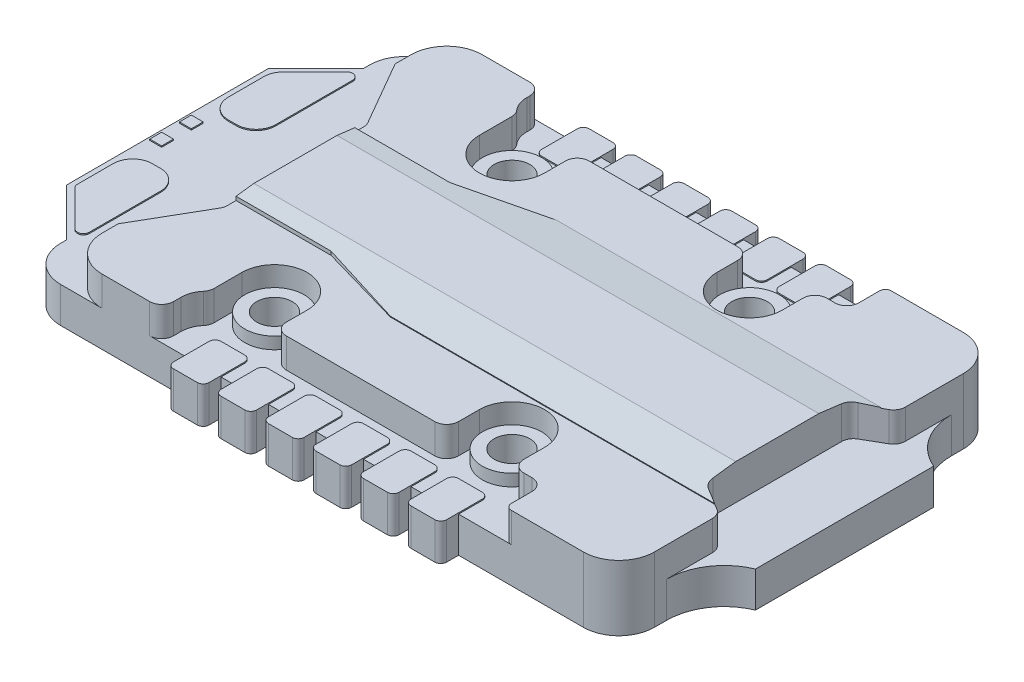
from build123d import *

# Parameters (mm, degrees)
BOSS_EXTRUDE1_DEPTH      = 3
SKETCH2_R                = 2.5
BOSS_EXTRUDE2_DEPTH      = 1
SKETCH3_R                = 1.5
CUT_EXTRUDE1_DEPTH       = 34.361654635
BOSS_EXTRUDE3_START      = 2.5
BOSS_EXTRUDE3_DEPTH      = 2.5
BOSS_EXTRUDE4_START      = 0.5
BOSS_EXTRUDE4_DEPTH      = 0.5
CUT_EXTRUDE2_DEPTH       = 50.015157952
CUT_EXTRUDE2_DEPTH_BACK  = 50.015157952
BOSS_EXTRUDE5_DEPTH      = 0.1
BOSS_EXTRUDE5_DEPTH_BACK = 3
SKETCH7_W                = 1
SKETCH7_H                = 1


with BuildPart() as part:
    # Sketch1 → Boss-Extrude1 (new body)
    with BuildSketch(Plane(origin=(0, 0, 0), x_dir=(1, 0, 0), z_dir=(0, 1, 0))):
        with BuildLine():
            Line((22, 16), (-22, 16))
            ThreePointArc((-22, 16), (-24.121320344, 15.121320344), (-25, 13))
            Line((-25, 13), (-25, 12.5))
            Line((-25, 12.5), (-29, 8.5))
            Line((-29, 8.5), (-29, -8.5))
            Line((-29, -8.5), (-25, -12.5))
            Line((-25, -12.5), (-25, -13))
            ThreePointArc((-25, -13), (-24.121320344, -15.121320344), (-22, -16))
            Line((-22, -16), (22, -16))
            ThreePointArc((22, -16), (24.121320344, -15.121320344), (25, -13))
            Line((25, -13), (25, -12))
            ThreePointArc((25, -12), (25.818754815, -9.295836543), (28, -7.5))
            Line((28, -7.5), (28, 7.5))
            ThreePointArc((28, 7.5), (25.818754815, 9.295836543), (25, 12))
            Line((25, 12), (25, 13))
            ThreePointArc((25, 13), (24.121320344, 15.121320344), (22, 16))
        make_face()
    extrude(amount=-BOSS_EXTRUDE1_DEPTH)

    # Sketch2 → Boss-Extrude2 (add)
    with BuildSketch(Plane(origin=(0, 0, 0), x_dir=(1, 0, 0), z_dir=(0, 1, 0))):
        with Locations(Location((-10, 10, 0), (0, 0, 270))):
            Circle(SKETCH2_R)
        with Locations(Location((10, 10, 0), (0, 0, 270))):
            Circle(SKETCH2_R)
        with Locations(Location((10, -10, 0), (0, 0, 270))):
            Circle(SKETCH2_R)
        with Locations(Location((-10, -10, 0), (0, 0, 270))):
            Circle(SKETCH2_R)
    extrude(amount=BOSS_EXTRUDE2_DEPTH)

    # Sketch3 → Cut-Extrude1 (cut, through all)
    with BuildSketch(Plane(origin=(0, 1, 0), x_dir=(1, 0, 0), z_dir=(0, 1, 0))):
        with Locations(Location((-10, 10, 0), (0, 0, 270))):
            Circle(SKETCH3_R)
        with Locations(Location((10, 10, 0), (0, 0, 270))):
            Circle(SKETCH3_R)
        with Locations(Location((10, -10, 0), (0, 0, 270))):
            Circle(SKETCH3_R)
        with Locations(Location((-10, -10, 0), (0, 0, 270))):
            Circle(SKETCH3_R)
    extrude(amount=-CUT_EXTRUDE1_DEPTH, mode=Mode.SUBTRACT)

    # Sketch4 → Boss-Extrude3 (add)
    with BuildSketch(Plane(origin=(0, 0, 0), x_dir=(1, 0, 0), z_dir=(0, 1, 0)).offset(BOSS_EXTRUDE3_START)):
        with BuildLine():
            ThreePointArc((-7.25, 10), (-10, 7.25), (-12.75, 10))
            Line((-12.75, 10), (-12.75, 12.734819154))
            ThreePointArc((-12.75, 12.734819154), (-12.813231765, 13.084769541), (-12.994930547, 13.390463967))
            ThreePointArc((-12.994930547, 13.390463967), (-13.36961025, 14.020834162), (-13.5, 14.742464244))
            Line((-13.5, 14.742464244), (-13.5, 15))
            ThreePointArc((-13.5, 15), (-13.792893219, 15.707106781), (-14.5, 16))
            Line((-14.5, 16), (-18.5, 16))
            ThreePointArc((-18.5, 16), (-20.621320344, 15.121320344), (-21.5, 13))
            Line((-21.5, 13), (-21.5, 11.658695779))
            Line((-21.5, 11.658695779), (-18.366925065, 6.232050808))
            ThreePointArc((-18.366925065, 6.232050808), (-18.267024642, 5.990869853), (-18.232950469, 5.732050808))
            Line((-18.232950469, 5.732050808), (-18.232950469, -5.732050808))
            ThreePointArc((-18.232950469, -5.732050808), (-18.267024642, -5.990869853), (-18.366925065, -6.232050808))
            Line((-18.366925065, -6.232050808), (-21.5, -11.658695779))
            Line((-21.5, -11.658695779), (-21.5, -13))
            ThreePointArc((-21.5, -13), (-20.621320344, -15.121320344), (-18.5, -16))
            Line((-18.5, -16), (-14.5, -16))
            ThreePointArc((-14.5, -16), (-13.792893219, -15.707106781), (-13.5, -15))
            Line((-13.5, -15), (-13.5, -14.357870566))
            ThreePointArc((-13.5, -14.357870566), (-13.368919263, -13.627827211), (-12.992052723, -12.988986799))
            ThreePointArc((-12.992052723, -12.988986799), (-12.81246406, -12.684559415), (-12.75, -12.336670982))
            Line((-12.75, -12.336670982), (-12.75, -10))
            ThreePointArc((-12.75, -10), (-10, -7.25), (-7.25, -10))
            Line((-7.25, -10), (-7.25, -11.75))
            ThreePointArc((-7.25, -11.75), (-6.957106781, -12.457106781), (-6.25, -12.75))
            Line((-6.25, -12.75), (6.25, -12.75))
            ThreePointArc((6.25, -12.75), (6.957106781, -12.457106781), (7.25, -11.75))
            Line((7.25, -11.75), (7.25, -10))
            ThreePointArc((7.25, -10), (10, -7.25), (12.75, -10))
            Line((12.75, -10), (12.75, -11.75))
            ThreePointArc((12.75, -11.75), (13.042893219, -12.457106781), (13.75, -12.75))
            Line((13.75, -12.75), (14.440772893, -12.75))
            ThreePointArc((14.440772893, -12.75), (15.147879675, -13.042893219), (15.440772893, -13.75))
            Line((15.440772893, -13.75), (15.440772893, -15.5))
            ThreePointArc((15.440772893, -15.5), (15.587219503, -15.853553391), (15.940772893, -16))
            Line((15.940772893, -16), (22, -16))
            ThreePointArc((22, -16), (24.121320344, -15.121320344), (25, -13))
            Line((25, -13), (25, -8.117354083))
            ThreePointArc((25, -8.117354083), (24.866025404, -7.617354083), (24.5, -7.251328679))
            Line((24.5, -7.251328679), (22.832635151, -6.288675135))
            ThreePointArc((22.832635151, -6.288675135), (22.466609747, -5.922649731), (22.332635151, -5.422649731))
            Line((22.332635151, -5.422649731), (22.332635151, 5.422649731))
            ThreePointArc((22.332635151, 5.422649731), (22.466609747, 5.922649731), (22.832635151, 6.288675135))
            Line((22.832635151, 6.288675135), (24.5, 7.251328679))
            ThreePointArc((24.5, 7.251328679), (24.866025404, 7.617354083), (25, 8.117354083))
            Line((25, 8.117354083), (25, 13))
            ThreePointArc((25, 13), (24.121320344, 15.121320344), (22, 16))
            Line((22, 16), (15.940772893, 16))
            ThreePointArc((15.940772893, 16), (15.587219503, 15.853553391), (15.440772893, 15.5))
            Line((15.440772893, 15.5), (15.440772893, 13.75))
            ThreePointArc((15.440772893, 13.75), (15.147879675, 13.042893219), (14.440772893, 12.75))
            Line((14.440772893, 12.75), (13.75, 12.75))
            ThreePointArc((13.75, 12.75), (13.042893219, 12.457106781), (12.75, 11.75))
            Line((12.75, 11.75), (12.75, 10))
            ThreePointArc((12.75, 10), (10, 7.25), (7.25, 10))
            Line((7.25, 10), (7.25, 11.75))
            ThreePointArc((7.25, 11.75), (6.957106781, 12.457106781), (6.25, 12.75))
            Line((6.25, 12.75), (-6.25, 12.75))
            ThreePointArc((-6.25, 12.75), (-6.957106781, 12.457106781), (-7.25, 11.75))
            Line((-7.25, 11.75), (-7.25, 10))
        make_face()
    extrude(amount=-BOSS_EXTRUDE3_DEPTH)

    # Sketch5 → Boss-Extrude4 (add)
    with BuildSketch(Plane(origin=(0, 2.5, 0), x_dir=(1, 0, 0), z_dir=(0, 1, 0)).offset(BOSS_EXTRUDE4_START)):
        with BuildLine():
            Line((-18.232950469, 5), (-10.232950469, 5))
            Line((-10.232950469, 5), (-3.232950469, 7))
            Line((-3.232950469, 7), (24.064685959, 7))
            Line((24.064685959, 7), (22.832635151, 6.288675135))
            ThreePointArc((22.832635151, 6.288675135), (22.466609747, 5.922649731), (22.332635151, 5.422649731))
            Line((22.332635151, 5.422649731), (22.332635151, -5.422649731))
            ThreePointArc((22.332635151, -5.422649731), (22.466609747, -5.922649731), (22.832635151, -6.288675135))
            Line((22.832635151, -6.288675135), (24.064685959, -7))
            Line((24.064685959, -7), (-3.232950469, -7))
            Line((-3.232950469, -7), (-10.232950469, -5))
            Line((-10.232950469, -5), (-18.232950469, -5))
            Line((-18.232950469, -5), (-18.232950469, 5))
        make_face()
    extrude(amount=-BOSS_EXTRUDE4_DEPTH)

    # Sketch6 → Cut-Extrude2 (cut, two sides: drawn at the far end of the back side and taken through both)
    with BuildSketch(Plane.ZY.offset(18.232950469).offset(-CUT_EXTRUDE2_DEPTH_BACK)):
        Polygon((-3.5, 3), (3.5, 3), (7.5, 2.5), (7.5, 6.225163496), (-7.5, 6.225163496), (-7.5, 2.5), align=None)
    extrude(amount=CUT_EXTRUDE2_DEPTH + CUT_EXTRUDE2_DEPTH_BACK, mode=Mode.SUBTRACT)

    # Sketch7 → Boss-Extrude5 (add, two sides: drawn at the far end of the back side and taken through both)
    with BuildSketch(Plane(origin=(0, 0, 0), x_dir=(1, 0, 0), z_dir=(0, 1, 0)).offset(-BOSS_EXTRUDE5_DEPTH_BACK)):
        with BuildLine():
            Line((-11, -13.5), (-9, -13.5))
            ThreePointArc((-9, -13.5), (-8.646446609, -13.646446609), (-8.5, -14))
            Line((-8.5, -14), (-8.5, -17))
            ThreePointArc((-8.5, -17), (-8.646446609, -17.353553391), (-9, -17.5))
            Line((-9, -17.5), (-11, -17.5))
            ThreePointArc((-11, -17.5), (-11.353553391, -17.353553391), (-11.5, -17))
            Line((-11.5, -17), (-11.5, -14))
            ThreePointArc((-11.5, -14), (-11.353553391, -13.646446609), (-11, -13.5))
        make_face()
        with BuildLine():
            Line((-7, -13.5), (-5, -13.5))
            ThreePointArc((-5, -13.5), (-4.646446609, -13.646446609), (-4.5, -14))
            Line((-4.5, -14), (-4.5, -17))
            ThreePointArc((-4.5, -17), (-4.646446609, -17.353553391), (-5, -17.5))
            Line((-5, -17.5), (-7, -17.5))
            ThreePointArc((-7, -17.5), (-7.353553391, -17.353553391), (-7.5, -17))
            Line((-7.5, -17), (-7.5, -14))
            ThreePointArc((-7.5, -14), (-7.353553391, -13.646446609), (-7, -13.5))
        make_face()
        with BuildLine():
            Line((-3, -13.5), (-1, -13.5))
            ThreePointArc((-1, -13.5), (-0.646446609, -13.646446609), (-0.5, -14))
            Line((-0.5, -14), (-0.5, -17))
            ThreePointArc((-0.5, -17), (-0.646446609, -17.353553391), (-1, -17.5))
            Line((-1, -17.5), (-3, -17.5))
            ThreePointArc((-3, -17.5), (-3.353553391, -17.353553391), (-3.5, -17))
            Line((-3.5, -17), (-3.5, -14))
            ThreePointArc((-3.5, -14), (-3.353553391, -13.646446609), (-3, -13.5))
        make_face()
        with BuildLine():
            Line((1, -13.5), (3, -13.5))
            ThreePointArc((3, -13.5), (3.353553391, -13.646446609), (3.5, -14))
            Line((3.5, -14), (3.5, -17))
            ThreePointArc((3.5, -17), (3.353553391, -17.353553391), (3, -17.5))
            Line((3, -17.5), (1, -17.5))
            ThreePointArc((1, -17.5), (0.646446609, -17.353553391), (0.5, -17))
            Line((0.5, -17), (0.5, -14))
            ThreePointArc((0.5, -14), (0.646446609, -13.646446609), (1, -13.5))
        make_face()
        with BuildLine():
            Line((5, -13.5), (7, -13.5))
            ThreePointArc((7, -13.5), (7.353553391, -13.646446609), (7.5, -14))
            Line((7.5, -14), (7.5, -17))
            ThreePointArc((7.5, -17), (7.353553391, -17.353553391), (7, -17.5))
            Line((7, -17.5), (5, -17.5))
            ThreePointArc((5, -17.5), (4.646446609, -17.353553391), (4.5, -17))
            Line((4.5, -17), (4.5, -14))
            ThreePointArc((4.5, -14), (4.646446609, -13.646446609), (5, -13.5))
        make_face()
        with BuildLine():
            Line((9, -13.5), (11, -13.5))
            ThreePointArc((11, -13.5), (11.353553391, -13.646446609), (11.5, -14))
            Line((11.5, -14), (11.5, -17))
            ThreePointArc((11.5, -17), (11.353553391, -17.353553391), (11, -17.5))
            Line((11, -17.5), (9, -17.5))
            ThreePointArc((9, -17.5), (8.646446609, -17.353553391), (8.5, -17))
            Line((8.5, -17), (8.5, -14))
            ThreePointArc((8.5, -14), (8.646446609, -13.646446609), (9, -13.5))
        make_face()
        with BuildLine():
            Line((-28.353553391, -8.439339828), (-26.505151476, -10.287741743))
            Line((-26.505151476, -10.287741743), (-25.353553391, -11.439339828))
            ThreePointArc((-25.353553391, -11.439339828), (-24.808658284, -11.547726204), (-24.5, -11.085786438))
            Line((-24.5, -11.085786438), (-24.5, -5.085786438))
            ThreePointArc((-24.5, -5.085786438), (-24.983741879, -3.917930232), (-26.151598085, -3.434188352))
            Line((-26.151598085, -3.434188352), (-26.848401915, -3.434188352))
            ThreePointArc((-26.848401915, -3.434188352), (-28.016258121, -3.917930232), (-28.5, -5.085786438))
            Line((-28.5, -5.085786438), (-28.5, -8.085786438))
            ThreePointArc((-28.5, -8.085786438), (-28.461939766, -8.277128154), (-28.353553391, -8.439339828))
        make_face()
        with BuildLine():
            Line((-11, 17.5), (-9, 17.5))
            ThreePointArc((-9, 17.5), (-8.646446609, 17.353553391), (-8.5, 17))
            Line((-8.5, 17), (-8.5, 14))
            ThreePointArc((-8.5, 14), (-8.646446609, 13.646446609), (-9, 13.5))
            Line((-9, 13.5), (-11, 13.5))
            ThreePointArc((-11, 13.5), (-11.353553391, 13.646446609), (-11.5, 14))
            Line((-11.5, 14), (-11.5, 17))
            ThreePointArc((-11.5, 17), (-11.353553391, 17.353553391), (-11, 17.5))
        make_face()
        with BuildLine():
            Line((-7, 17.5), (-5, 17.5))
            ThreePointArc((-5, 17.5), (-4.646446609, 17.353553391), (-4.5, 17))
            Line((-4.5, 17), (-4.5, 14))
            ThreePointArc((-4.5, 14), (-4.646446609, 13.646446609), (-5, 13.5))
            Line((-5, 13.5), (-7, 13.5))
            ThreePointArc((-7, 13.5), (-7.353553391, 13.646446609), (-7.5, 14))
            Line((-7.5, 14), (-7.5, 17))
            ThreePointArc((-7.5, 17), (-7.353553391, 17.353553391), (-7, 17.5))
        make_face()
        with BuildLine():
            Line((-3, 17.5), (-1, 17.5))
            ThreePointArc((-1, 17.5), (-0.646446609, 17.353553391), (-0.5, 17))
            Line((-0.5, 17), (-0.5, 14))
            ThreePointArc((-0.5, 14), (-0.646446609, 13.646446609), (-1, 13.5))
            Line((-1, 13.5), (-3, 13.5))
            ThreePointArc((-3, 13.5), (-3.353553391, 13.646446609), (-3.5, 14))
            Line((-3.5, 14), (-3.5, 17))
            ThreePointArc((-3.5, 17), (-3.353553391, 17.353553391), (-3, 17.5))
        make_face()
        with BuildLine():
            Line((1, 17.5), (3, 17.5))
            ThreePointArc((3, 17.5), (3.353553391, 17.353553391), (3.5, 17))
            Line((3.5, 17), (3.5, 14))
            ThreePointArc((3.5, 14), (3.353553391, 13.646446609), (3, 13.5))
            Line((3, 13.5), (1, 13.5))
            ThreePointArc((1, 13.5), (0.646446609, 13.646446609), (0.5, 14))
            Line((0.5, 14), (0.5, 17))
            ThreePointArc((0.5, 17), (0.646446609, 17.353553391), (1, 17.5))
        make_face()
        with BuildLine():
            Line((5, 17.5), (7, 17.5))
            ThreePointArc((7, 17.5), (7.353553391, 17.353553391), (7.5, 17))
            Line((7.5, 17), (7.5, 14))
            ThreePointArc((7.5, 14), (7.353553391, 13.646446609), (7, 13.5))
            Line((7, 13.5), (5, 13.5))
            ThreePointArc((5, 13.5), (4.646446609, 13.646446609), (4.5, 14))
            Line((4.5, 14), (4.5, 17))
            ThreePointArc((4.5, 17), (4.646446609, 17.353553391), (5, 17.5))
        make_face()
        with BuildLine():
            Line((9, 17.5), (11, 17.5))
            ThreePointArc((11, 17.5), (11.353553391, 17.353553391), (11.5, 17))
            Line((11.5, 17), (11.5, 14))
            ThreePointArc((11.5, 14), (11.353553391, 13.646446609), (11, 13.5))
            Line((11, 13.5), (9, 13.5))
            ThreePointArc((9, 13.5), (8.646446609, 13.646446609), (8.5, 14))
            Line((8.5, 14), (8.5, 17))
            ThreePointArc((8.5, 17), (8.646446609, 17.353553391), (9, 17.5))
        make_face()
        with BuildLine():
            Line((-26.848401915, 2.957180807), (-26.151598085, 2.957180807))
            ThreePointArc((-26.151598085, 2.957180807), (-24.983741879, 3.440922687), (-24.5, 4.608778892))
            Line((-24.5, 4.608778892), (-24.5, 8.305582722))
            Line((-24.5, 8.305582722), (-24.5, 11.085786438))
            ThreePointArc((-24.5, 11.085786438), (-24.808658284, 11.547726204), (-25.353553391, 11.439339828))
            Line((-25.353553391, 11.439339828), (-28.016258121, 8.776635098))
            ThreePointArc((-28.016258121, 8.776635098), (-28.374279582, 8.240818116), (-28.5, 7.608778892))
            Line((-28.5, 7.608778892), (-28.5, 4.608778892))
            ThreePointArc((-28.5, 4.608778892), (-28.016258121, 3.440922687), (-26.848401915, 2.957180807))
        make_face()
        with Locations((-28.25, 1.25)):
            Rectangle(SKETCH7_W, SKETCH7_H)
        with Locations((-28.25, -1.25)):
            Rectangle(SKETCH7_W, SKETCH7_H)
    extrude(amount=BOSS_EXTRUDE5_DEPTH + BOSS_EXTRUDE5_DEPTH_BACK)


solid = part.part
